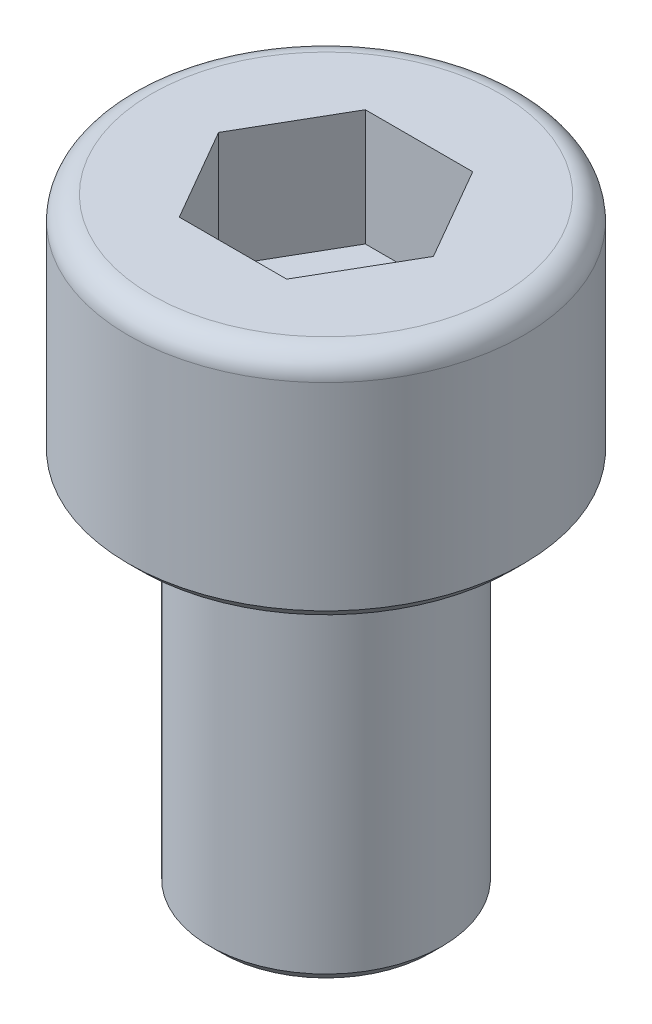
from build123d import *

# Parameters (mm, degrees)
CUT_EXTRUDE1_DEPTH = 2.5
FILLET1_R          = 0.5
CHAMFER1_SIZE      = 0.25
CHAMFER2_SIZE      = 0.25


with BuildPart() as part:
    # Sketch1 → Revolve1 (revolve)
    with BuildSketch(Plane.XY):
        Polygon((0, 0), (4.25, 0), (4.25, -5), (2.5, -5), (2.5, -13), (0, -13), align=None)
    revolve(axis=Axis((0, -18, 0), (0, 1, 0)))

    # Sketch2 → Cut-Extrude1 (cut)
    with BuildSketch(Plane(origin=(0, 0, 0), x_dir=(1, 0, 0), z_dir=(0, 1, 0))):
        Polygon((2.309401077, 0), (1.154700538, 2), (-1.154700538, 2), (-2.309401077, 0), (-1.154700538, -2), (1.154700538, -2), align=None)
    extrude(amount=-CUT_EXTRUDE1_DEPTH, mode=Mode.SUBTRACT)

    # Fillet1
    fillet1_edges = [part.edges().sort_by_distance(p)[0] for p in [
        (-4.25, 0, 0),
    ]]
    fillet(fillet1_edges, radius=FILLET1_R)

    # Chamfer1
    chamfer1_edges = [part.edges().sort_by_distance(p)[0] for p in [
        (-4.25, -5, 0),
    ]]
    chamfer(chamfer1_edges, length=CHAMFER1_SIZE)

    # Chamfer2
    chamfer2_edges = [part.edges().sort_by_distance(p)[0] for p in [
        (-2.5, -13, 0),
    ]]
    chamfer(chamfer2_edges, length=CHAMFER2_SIZE)


solid = part.part
